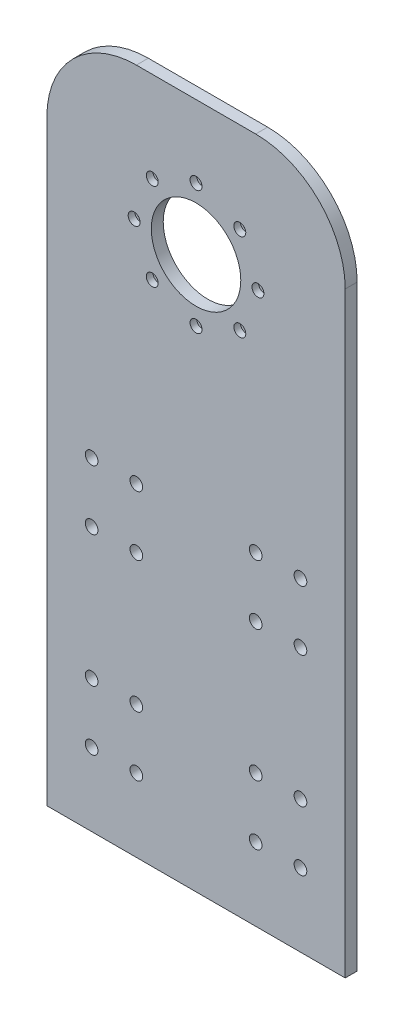
from build123d import *

# Parameters (mm, degrees)
SKETCH_1_W          = 200
SKETCH_1_H          = 460
EXTRUDE_1_DEPTH     = 8
SKETCH_2_R          = 30
CUT_EXTRUDE_1_DEPTH = 10
SKETCH_3_R          = 2.25
CUT_EXTRUDE_2_DEPTH = 10
SKETCH_4_R          = 4
CUT_EXTRUDE_3_DEPTH = 4.4
FILLET_1_R          = 60
SKETCH_5_R          = 4.25
CUT_EXTRUDE_4_DEPTH = 10


with BuildPart() as part:
    # 草图1 → 凸台-拉伸1 (new body)
    with BuildSketch(Plane.XY):
        with Locations((0, 230)):
            Rectangle(SKETCH_1_W, SKETCH_1_H)
    extrude(amount=EXTRUDE_1_DEPTH)

    # 草图2 → 切除-拉伸1 (cut)
    with BuildSketch(Plane(origin=(0, 0, 0), x_dir=(-1, 0, 0), z_dir=(0, 0, -1))):
        with Locations((0, 370)):
            Circle(SKETCH_2_R)
    extrude(amount=-CUT_EXTRUDE_1_DEPTH, mode=Mode.SUBTRACT)

    # 草图3 → 切除-拉伸2 (cut)
    with BuildSketch(Plane(origin=(0, 0, 0), x_dir=(-1, 0, 0), z_dir=(0, 0, -1))):
        with Locations((0, 411.5)):
            Circle(SKETCH_3_R)
        with Locations((29.344931419, 399.344931419)):
            Circle(SKETCH_3_R)
        with Locations((41.5, 370)):
            Circle(SKETCH_3_R)
        with Locations((29.344931419, 340.655068581)):
            Circle(SKETCH_3_R)
        with Locations((0, 328.5)):
            Circle(SKETCH_3_R)
        with Locations((-29.344931419, 340.655068581)):
            Circle(SKETCH_3_R)
        with Locations((-41.5, 370)):
            Circle(SKETCH_3_R)
        with Locations((-29.344931419, 399.344931419)):
            Circle(SKETCH_3_R)
    extrude(amount=-CUT_EXTRUDE_2_DEPTH, mode=Mode.SUBTRACT)

    # 草图4 → 切除-拉伸3 (cut)
    with BuildSketch(Plane.XY.offset(8)):
        with Locations((29.344931419, 399.344931419)):
            Circle(SKETCH_4_R)
        with Locations((41.5, 370)):
            Circle(SKETCH_4_R)
        with Locations((29.344931419, 340.655068581)):
            Circle(SKETCH_4_R)
        with Locations((0, 328.5)):
            Circle(SKETCH_4_R)
        with Locations((-29.344931419, 340.655068581)):
            Circle(SKETCH_4_R)
        with Locations((-41.5, 370)):
            Circle(SKETCH_4_R)
        with Locations((-29.344931419, 399.344931419)):
            Circle(SKETCH_4_R)
        with Locations((0, 411.5)):
            Circle(SKETCH_4_R)
    extrude(amount=-CUT_EXTRUDE_3_DEPTH, mode=Mode.SUBTRACT)

    # 圆角1
    fillet_1_edges = [part.edges().sort_by_distance(p)[0] for p in [
        (100, 460, 4),
        (-100, 460, 4),
    ]]
    fillet(fillet_1_edges, radius=FILLET_1_R)

    # 草图5 → 切除-拉伸4 (cut)
    with BuildSketch(Plane(origin=(0, 0, 0), x_dir=(-1, 0, 0), z_dir=(0, 0, -1))):
        with Locations((40, 49)):
            Circle(SKETCH_5_R)
        with Locations((70, 49)):
            Circle(SKETCH_5_R)
        with Locations((40, 89)):
            Circle(SKETCH_5_R)
        with Locations((70, 89)):
            Circle(SKETCH_5_R)
        with Locations((40, 217)):
            Circle(SKETCH_5_R)
        with Locations((40, 177)):
            Circle(SKETCH_5_R)
        with Locations((70, 177)):
            Circle(SKETCH_5_R)
        with Locations((70, 217)):
            Circle(SKETCH_5_R)
        with Locations(Location((-70, 217, 0), (0, 0, 180))):
            Circle(SKETCH_5_R)
        with Locations(Location((-70, 177, 0), (0, 0, 180))):
            Circle(SKETCH_5_R)
        with Locations(Location((-40, 177, 0), (0, 0, 180))):
            Circle(SKETCH_5_R)
        with Locations(Location((-40, 217, 0), (0, 0, 180))):
            Circle(SKETCH_5_R)
        with Locations(Location((-70, 89, 0), (0, 0, 180))):
            Circle(SKETCH_5_R)
        with Locations(Location((-40, 89, 0), (0, 0, 180))):
            Circle(SKETCH_5_R)
        with Locations(Location((-70, 49, 0), (0, 0, 180))):
            Circle(SKETCH_5_R)
        with Locations(Location((-40, 49, 0), (0, 0, 180))):
            Circle(SKETCH_5_R)
    extrude(amount=-CUT_EXTRUDE_4_DEPTH, mode=Mode.SUBTRACT)


solid = part.part
